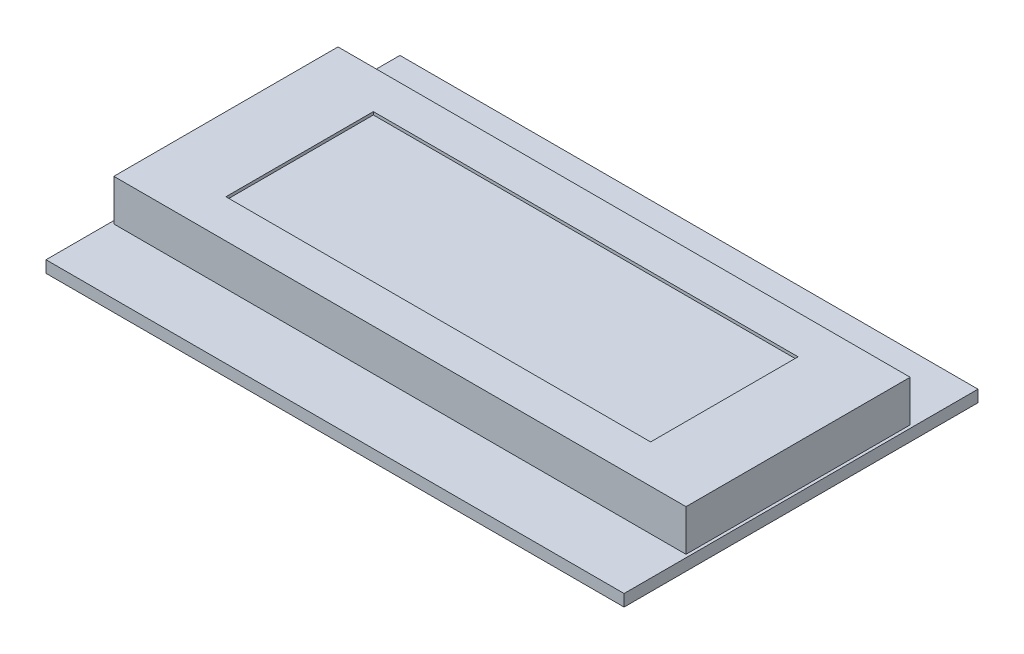
from build123d import *

# Parameters (mm, degrees)
SKETCH1_W           = 98
SKETCH1_H           = 60
BOSS_EXTRUDE1_DEPTH = 2
SKETCH2_W           = 97
SKETCH2_H           = 38
BOSS_EXTRUDE2_DEPTH = 7
SKETCH4_W           = 72
SKETCH4_H           = 25
CUT_EXTRUDE1_DEPTH  = 0.5


with BuildPart() as part:
    # Sketch1 → Boss-Extrude1 (new body)
    with BuildSketch(Plane(origin=(0, 0, 0), x_dir=(1, 0, 0), z_dir=(0, 1, 0))):
        Rectangle(SKETCH1_W, SKETCH1_H)
    extrude(amount=BOSS_EXTRUDE1_DEPTH)

    # Sketch2 → Boss-Extrude2 (add)
    with BuildSketch(Plane(origin=(0, 2, 0), x_dir=(1, 0, 0), z_dir=(0, 1, 0))):
        Rectangle(SKETCH2_W, SKETCH2_H)
    extrude(amount=BOSS_EXTRUDE2_DEPTH)

    # Sketch4 → Cut-Extrude1 (cut)
    with BuildSketch(Plane(origin=(0, 9, 0), x_dir=(1, 0, 0), z_dir=(0, 1, 0))):
        Rectangle(SKETCH4_W, SKETCH4_H)
    extrude(amount=-CUT_EXTRUDE1_DEPTH, mode=Mode.SUBTRACT)


solid = part.part
